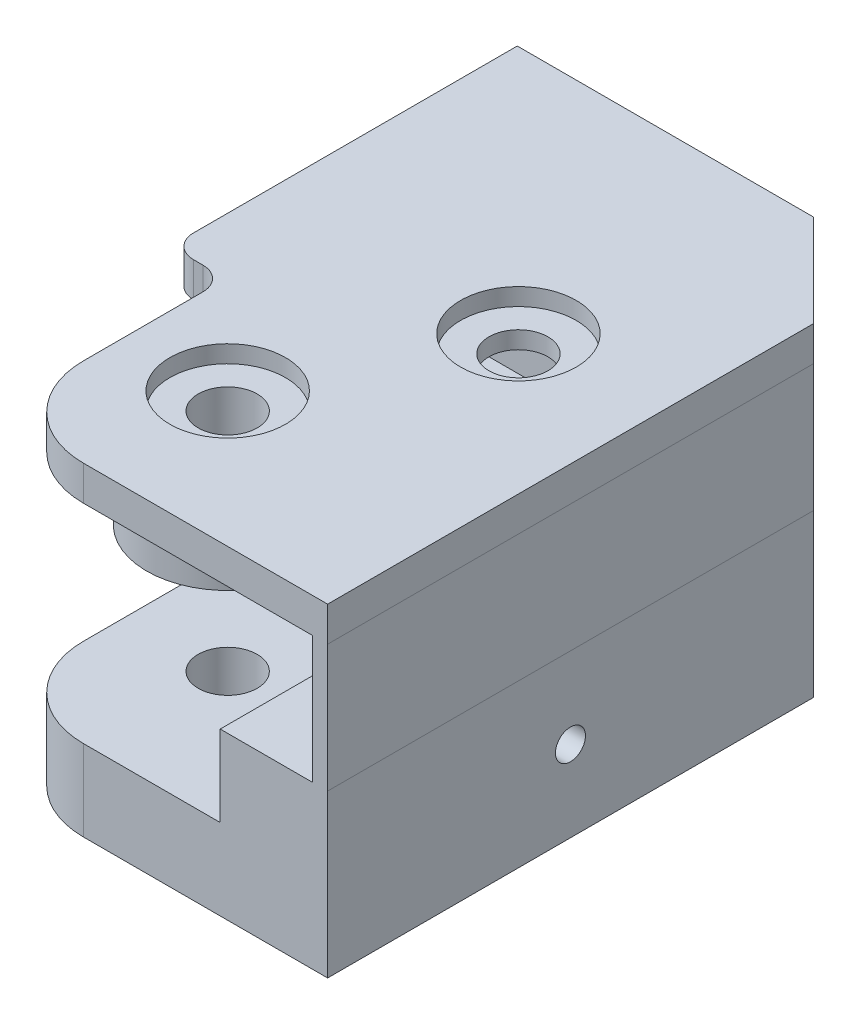
from build123d import *

# Parameters (mm, degrees)
SKETCH_1_R          = 2.55
EXTRUDE_1_DEPTH     = 7
SKETCH_3_R          = 2.55
EXTRUDE_2_DEPTH     = 7
EXTRUDE_3_DEPTH     = 11
SKETCH_5_R          = 2.55
EXTRUDE_4_DEPTH     = 3
EXTRUDE_START       = 7
SKETCH_6_R          = 7
SKETCH_6_R_2        = 2.55
EXTRUDE_5_DEPTH     = 7
SKETCH_7_R          = 1.3
CUT_EXTRUDE_1_DEPTH = 5
SKETCH_8_R          = 1.3
CUT_EXTRUDE_2_DEPTH = 5
SKETCH_9_R          = 5
CUT_EXTRUDE_3_DEPTH = 1.5
CUT_EXTRUDE_4_REACH = 38.718
FILLET_1_R          = 2


with BuildPart() as part:
    # Эскиз1 → Бобышка-Вытянуть1 (new body)
    with BuildSketch(Plane(origin=(0, 0, 0), x_dir=(1, 0, 0), z_dir=(0, 1, 0))):
        with BuildLine():
            Line((8.8, 25), (-16.8, 25))
            Line((-16.8, 25), (-16.8, -3))
            ThreePointArc((-16.8, -3), (-16.214213562, -4.414213562), (-14.8, -5))
            Line((-14.8, -5), (-13.979301231, -5))
            ThreePointArc((-13.979301231, -5), (-12.565087669, -5.585786438), (-11.979301231, -7))
            Line((-11.979301231, -7), (-11.979301231, -23))
            ThreePointArc((-11.979301231, -23), (-11.393514794, -24.414213562), (-9.979301231, -25))
            Line((-9.979301231, -25), (16.8, -25))
            Line((16.8, -25), (16.8, 17))
            Line((16.8, 17), (8.8, 25))
        make_face()
        with Locations(Location((4.8, 3.5, 0), (0, 0, 270))):
            Circle(SKETCH_1_R, mode=Mode.SUBTRACT)
        with Locations(Location((-3.489533647, -13.352791034, 0), (0, 0, 270))):
            Circle(SKETCH_1_R, mode=Mode.SUBTRACT)
    extrude(amount=EXTRUDE_1_DEPTH)

    # Эскиз3 → Бобышка-Вытянуть2 (add)
    with BuildSketch(Plane(origin=(0, 7, 0), x_dir=(1, 0, 0), z_dir=(0, 1, 0))):
        with BuildLine():
            Line((8.8, 25), (-16.8, 25))
            Line((-16.8, 25), (-16.8, -2.352791034))
            Line((-16.8, -2.352791034), (-3.489533647, -2.352791034))
            ThreePointArc((-3.489533647, -2.352791034), (4.288640946, -5.574616441), (7.510466353, -13.352791034))
            Line((7.510466353, -13.352791034), (7.510466353, -25))
            Line((7.510466353, -25), (16.8, -25))
            Line((16.8, -25), (16.8, 17))
            Line((16.8, 17), (8.8, 25))
        make_face()
        with Locations(Location((4.8, 3.5, 0), (0, 0, 270))):
            Circle(SKETCH_3_R, mode=Mode.SUBTRACT)
    extrude(amount=EXTRUDE_2_DEPTH)

    # Эскиз4 → Бобышка-Вытянуть3 (add)
    with BuildSketch(Plane(origin=(0, 14, 0), x_dir=(1, 0, 0), z_dir=(0, 1, 0))):
        with BuildLine():
            Line((8.800011647, 25), (-16.8, 25))
            Line((-16.8, 25), (-16.8, 14.5))
            Line((-16.8, 14.5), (4.8, 14.5))
            ThreePointArc((4.8, 14.5), (13.433239095, 10.316684145), (15.500011647, 0.948578679))
            Line((15.500011647, 0.948578679), (15.500011647, -25))
            Line((15.500011647, -25), (16.800011647, -25))
            Line((16.800011647, -25), (16.800011647, 17))
            Line((16.800011647, 17), (8.800011647, 25))
        make_face()
    extrude(amount=EXTRUDE_3_DEPTH)

    # Эскиз5 → Бобышка-Вытянуть4 (add)
    with BuildSketch(Plane(origin=(0, 25, 0), x_dir=(1, 0, 0), z_dir=(0, 1, 0))):
        with BuildLine():
            Line((8.8, 25), (-16.8, 25))
            Line((-16.8, 25), (-16.8, -3))
            ThreePointArc((-16.8, -3), (-16.214213562, -4.414213562), (-14.8, -5))
            Line((-14.8, -5), (-13.979301231, -5))
            ThreePointArc((-13.979301231, -5), (-12.565087669, -5.585786438), (-11.979301231, -7))
            Line((-11.979301231, -7), (-11.979301231, -17.343145751))
            ThreePointArc((-11.979301231, -17.343145751), (-9.736660544, -22.757359313), (-4.322446982, -25))
            Line((-4.322446982, -25), (16.8, -25))
            Line((16.8, -25), (16.8, 17))
            Line((16.8, 17), (8.8, 25))
        make_face()
        with Locations(Location((4.8, 3.5, 0), (0, 0, 270))):
            Circle(SKETCH_5_R, mode=Mode.SUBTRACT)
        with Locations(Location((-3.489533647, -13.352791034, 0), (0, 0, 270))):
            Circle(SKETCH_5_R, mode=Mode.SUBTRACT)
    extrude(amount=EXTRUDE_4_DEPTH)

    # Эскиз6 → Бобышка-Вытянуть5 (add)
    with BuildSketch(Plane.XZ.offset(-25).offset(EXTRUDE_START)):
        with Locations(Location((-3.489533647, 13.352791034, 0), (0, 0, 90))):
            Circle(SKETCH_6_R)
        with Locations(Location((-3.489533647, 13.352791034, 0), (0, 0, 90))):
            Circle(SKETCH_6_R_2, mode=Mode.SUBTRACT)
    extrude(amount=-EXTRUDE_5_DEPTH)

    # Эскиз7 → Вырез-Вытянуть1 (cut)
    with BuildSketch(Plane(origin=(0, 0, -25), x_dir=(-1, 0, 0), z_dir=(0, 0, -1))):
        with Locations((4, 13.75)):
            Circle(SKETCH_7_R)
    extrude(amount=-CUT_EXTRUDE_1_DEPTH, mode=Mode.SUBTRACT)

    # Эскиз8 → Вырез-Вытянуть2 (cut)
    with BuildSketch(Plane(origin=(16.8, 0, 0), x_dir=(0, 0, -1), z_dir=(1, 0, 0))):
        with Locations((-4, 7)):
            Circle(SKETCH_8_R)
    extrude(amount=-CUT_EXTRUDE_2_DEPTH, mode=Mode.SUBTRACT)

    # Эскиз9 → Вырез-Вытянуть3 (cut)
    with BuildSketch(Plane(origin=(0, 28, 0), x_dir=(1, 0, 0), z_dir=(0, 1, 0))):
        with Locations(Location((4.8, 3.5, 0), (0, 0, 270))):
            Circle(SKETCH_9_R)
        with Locations(Location((-3.489533647, -13.352791034, 0), (0, 0, 270))):
            Circle(SKETCH_9_R)
    extrude(amount=-CUT_EXTRUDE_3_DEPTH, mode=Mode.SUBTRACT)

    # Эскиз11 → Вырез-Вытянуть4 (cut, up to next)
    with BuildSketch(Plane(origin=(0, 7, 0), x_dir=(1, 0, 0), z_dir=(0, 1, 0)), mode=Mode.PRIVATE) as cut_extrude_4_sk1:
        with BuildLine():
            Line((-11.979301231, -17.343145751), (-11.979301231, -25))
            Line((-11.979301231, -25), (-4.322446982, -25))
            ThreePointArc((-4.322446982, -25), (-9.736660544, -22.757359313), (-11.979301231, -17.343145751))
        make_face()
    cut_extrude_4_tool1 = extrude(cut_extrude_4_sk1.sketch, amount=-CUT_EXTRUDE_4_REACH, mode=Mode.PRIVATE) & part.part
    add(cut_extrude_4_tool1.solids().sort_by_distance((-10.269005, 7, 23.289704))[0], mode=Mode.SUBTRACT)

    # Скругление1
    fillet_1_edges = [part.edges().sort_by_distance(p)[0] for p in [
        (-3.489533647, 25, 6.352791034),
    ]]
    fillet(fillet_1_edges, radius=FILLET_1_R)


solid = part.part
